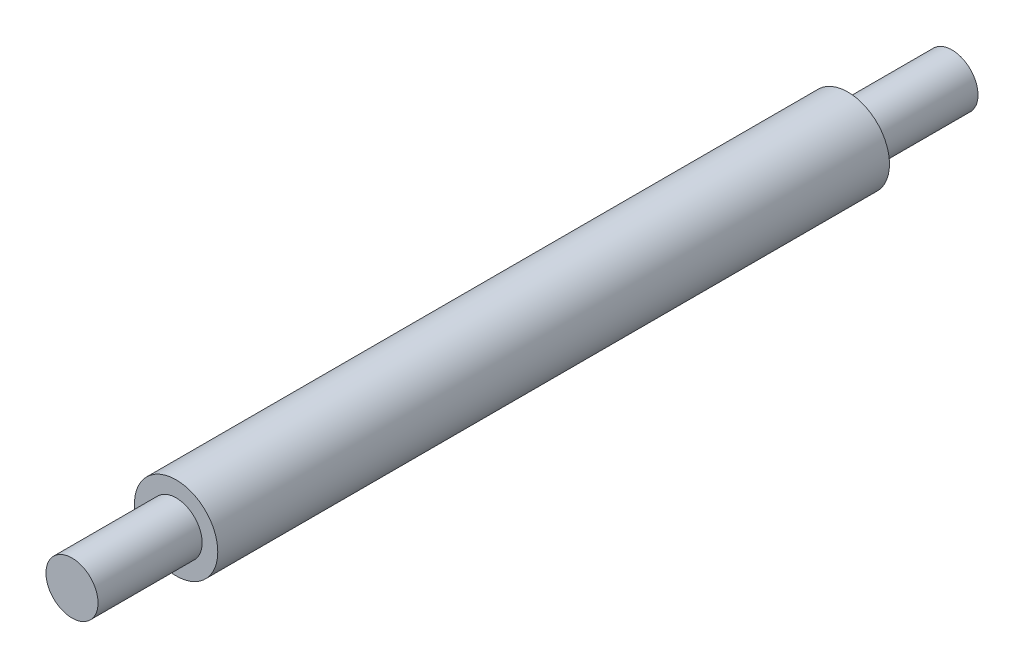
from build123d import *

# Parameters (mm, degrees)
SKETCH1_R           = 101.6
BOSS_EXTRUDE1_DEPTH = 819.15
SKETCH2_R           = 63.5
BOSS_EXTRUDE2_DEPTH = 254


with BuildPart() as part:
    # Sketch1 → Boss-Extrude1 (new, symmetric)
    with BuildSketch(Plane.XY):
        Circle(SKETCH1_R)
    extrude(amount=BOSS_EXTRUDE1_DEPTH, both=True)

    # Sketch2 → Boss-Extrude2 (add)
    with BuildSketch(Plane.XY.offset(819.15)):
        Circle(SKETCH2_R)
    boss_extrude2 = extrude(amount=BOSS_EXTRUDE2_DEPTH)

    # Mirror1: Boss-Extrude2 across plane
    add(boss_extrude2.mirror(Plane.XY))


solid = part.part
